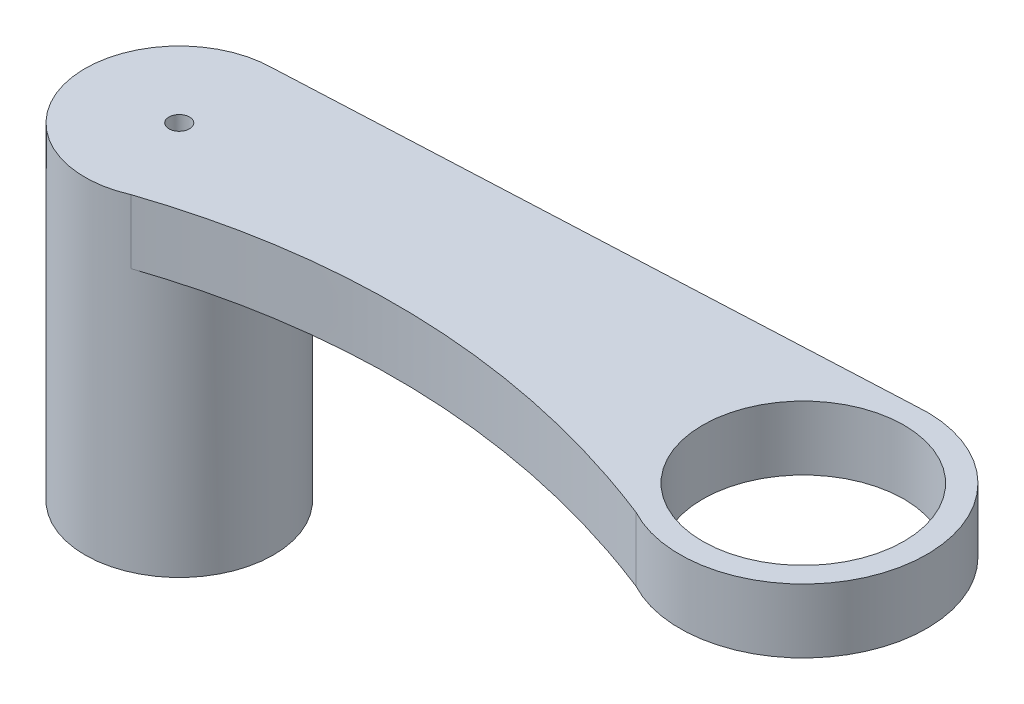
from build123d import *

# Parameters (mm, degrees)
SZKIC1_R                    = 10.3
DODANIE_WYCI_GNI_CIE1_DEPTH = 35.75
OTWORY_USTALAJ_CE_2_5MM2_D  = 2.25
DODANIE_WYCI_GNI_CIE3_START = -7
DODANIE_WYCI_GNI_CIE3_DEPTH = 7
OTWORY_USTALAJ_CE_2_5MM3_D  = 22
SZKIC12_R                   = 0.7
WYTNIJ_WYCI_GNI_CIE1_DEPTH  = 7


with BuildPart() as part:
    # Szkic1 → Dodanie-wyciągnięcie1 (new body)
    with BuildSketch(Plane(origin=(0, 0, 0), x_dir=(1, 0, 0), z_dir=(0, 1, 0))):
        Circle(SZKIC1_R)
    extrude(amount=DODANIE_WYCI_GNI_CIE1_DEPTH)

    # Otwory ustalające Ø2.5mm2 (through all)
    with Locations(Plane.XZ):
        with Locations((0, 0)):
            Hole(OTWORY_USTALAJ_CE_2_5MM2_D / 2)

    # Szkic7 → Dodanie-wyciągnięcie3 (add)
    with BuildSketch(Plane(origin=(0, 35.75, 0), x_dir=(1, 0, 0), z_dir=(0, 1, 0)).offset(DODANIE_WYCI_GNI_CIE3_START)):
        with BuildLine():
            Line((66.943357066, 13.440701035), (0, 10.3))
            ThreePointArc((0, 10.3), (10.077130906, 2.131063748), (4.169904535, -9.418168408))
            add(Edge.make_bspline(
                [(4.169904535, -9.418168408), (22.461776037, -3.24596138), (41.934151815, -4.077243057), (61.820006497, -11.893378905)],
                knots=[0, 0, 0, 0, 1, 1, 1, 1], degree=3))
            ThreePointArc((61.820006497, -11.893378905), (81.439431711, -2.675954354), (66.943357066, 13.440701035))
        make_face()
    extrude(amount=DODANIE_WYCI_GNI_CIE3_DEPTH)

    # Otwory ustalające Ø2.5mm3 (through all)
    with Locations(Plane(origin=(0, 35.75, 0), x_dir=(1, 0, 0), z_dir=(0, 1, 0))):
        with Locations((68.207301561, 0)):
            Hole(OTWORY_USTALAJ_CE_2_5MM3_D / 2)

    # Szkic12 → Wytnij-wyciągnięcie1 (cut)
    with BuildSketch(Plane.XZ):
        with Locations((7.24, 0)):
            Circle(SZKIC12_R)
        with Locations((-7.24, 0)):
            Circle(SZKIC12_R)
        with Locations((0, -7.24)):
            Circle(SZKIC12_R)
        with Locations((0, 7.24)):
            Circle(SZKIC12_R)
    extrude(amount=-WYTNIJ_WYCI_GNI_CIE1_DEPTH, mode=Mode.SUBTRACT)


solid = part.part
